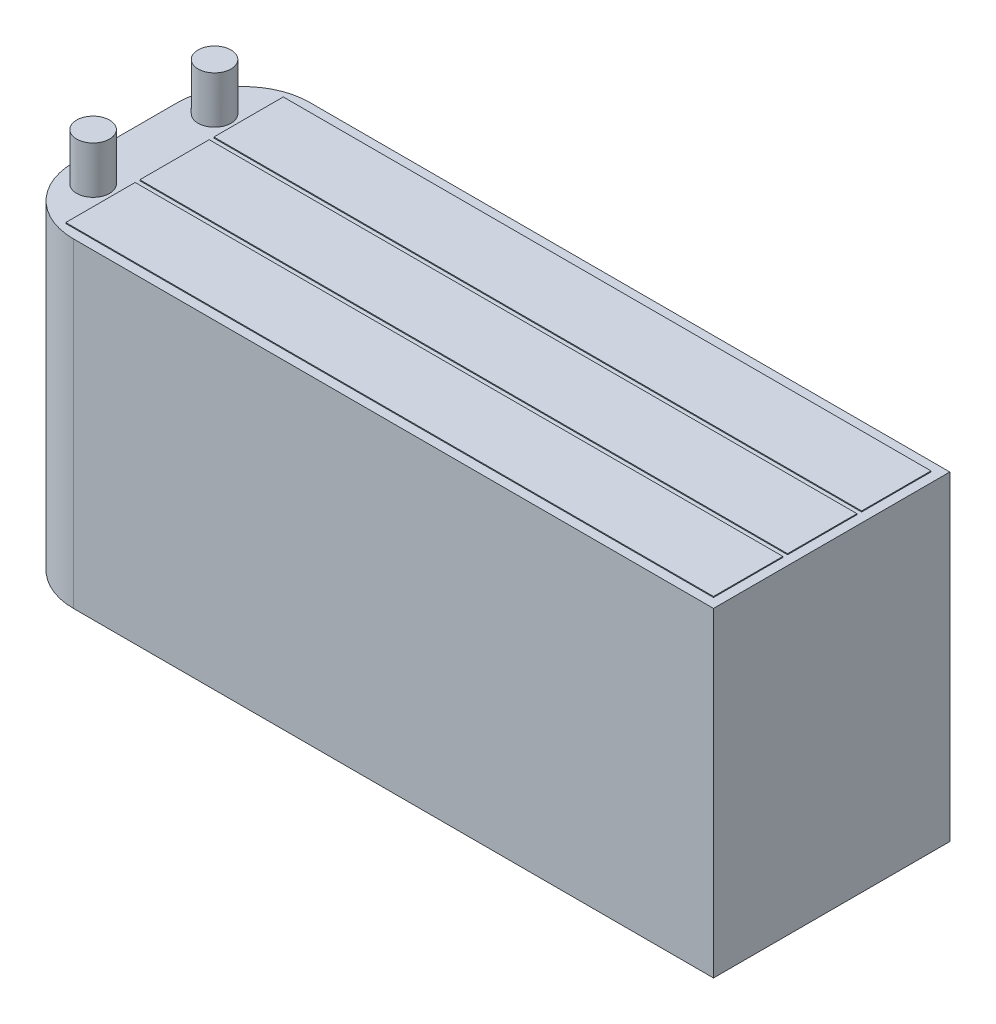
from build123d import *

# Parameters (mm, degrees)
SKETCH1_W             = 75
SKETCH1_H             = 34
BOSS_EXTRUDE1_DEPTH   = 25.1
FILLET1_R             = 7
SKETCH2_W             = 68.8
SKETCH2_H             = 7.366666667
BOSS_EXTRUDE2_DEPTH   = 0.1
SKETCH2_H_2           = 7.366666666
BOSS_EXTRUDE2_2_DEPTH = 0.1
BOSS_EXTRUDE2_3_DEPTH = 0.1
SKETCH3_R             = 1.75
BOSS_EXTRUDE3_DEPTH   = 5


with BuildPart() as part:
    # Sketch1 → Boss-Extrude1 (new body)
    with BuildSketch(Plane.XY):
        Rectangle(SKETCH1_W, SKETCH1_H)
    extrude(amount=BOSS_EXTRUDE1_DEPTH)

    # Fillet1
    fillet1_edges = [part.edges().sort_by_distance(p)[0] for p in [
        (-37.5, 0, 25.1),
        (-37.5, 0, 0),
    ]]
    fillet(fillet1_edges, radius=FILLET1_R)

    # Sketch3 → Boss-Extrude3 (add)
    with BuildSketch(Plane(origin=(0, 17, 0), x_dir=(1, 0, 0), z_dir=(0, 1, 0))):
        with Locations(Location((-34.5, -6.1, 0), (0, 0, 90))):
            Circle(SKETCH3_R)
        with Locations(Location((-34.5, -19, 0), (0, 0, 90))):
            Circle(SKETCH3_R)
    extrude(amount=BOSS_EXTRUDE3_DEPTH)


with BuildPart() as body_2:
    # Sketch2 → Boss-Extrude2 (new body)
    with BuildSketch(Plane(origin=(0, 17, 0), x_dir=(1, 0, 0), z_dir=(0, 1, 0))):
        with Locations((2.1, -4.683333334)):
            Rectangle(SKETCH2_W, SKETCH2_H)
    extrude(amount=BOSS_EXTRUDE2_DEPTH)


with BuildPart() as body_3:
    # Sketch2 → Boss-Extrude2 2 (new body)
    with BuildSketch(Plane(origin=(0, 17, 0), x_dir=(1, 0, 0), z_dir=(0, 1, 0))):
        with Locations((2.1, -12.55)):
            Rectangle(SKETCH2_W, SKETCH2_H_2)
    extrude(amount=BOSS_EXTRUDE2_2_DEPTH)


with BuildPart() as body_4:
    # Sketch2 → Boss-Extrude2 3 (new body)
    with BuildSketch(Plane(origin=(0, 17, 0), x_dir=(1, 0, 0), z_dir=(0, 1, 0))):
        with Locations((2.1, -20.416666666)):
            Rectangle(SKETCH2_W, SKETCH2_H)
    extrude(amount=BOSS_EXTRUDE2_3_DEPTH)


with BuildPart() as body_5:
    # Mirror1: mirrored copy
    add(body_4.part.mirror(Plane.ZX))


with BuildPart() as body_6:
    # Mirror1 2: mirrored copy
    add(body_3.part.mirror(Plane.ZX))


with BuildPart() as body_7:
    # Mirror1 3: mirrored copy
    add(body_2.part.mirror(Plane.ZX))


solid = Compound([part.part, body_2.part, body_3.part, body_4.part, body_5.part, body_6.part, body_7.part])
